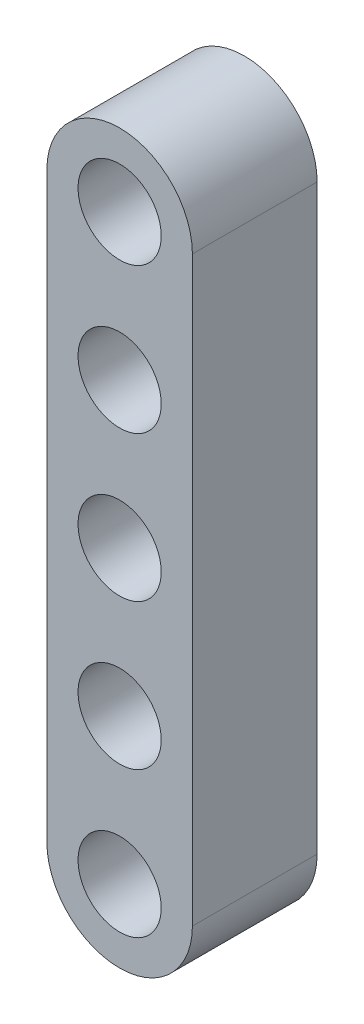
from build123d import *

# Parameters (mm, degrees)
SKETCH1_R           = 2
BOSS_EXTRUDE1_DEPTH = 6


with BuildPart() as part:
    # Sketch1 → Boss-Extrude1 (new body)
    with BuildSketch(Plane.XY):
        with BuildLine():
            Line((-3.5, 0), (-3.5, 28))
            ThreePointArc((-3.5, 28), (0, 31.5), (3.5, 28))
            Line((3.5, 28), (3.5, 0))
            ThreePointArc((3.5, 0), (0, -3.5), (-3.5, 0))
        make_face()
        Circle(SKETCH1_R, mode=Mode.SUBTRACT)
        with Locations((0, 7)):
            Circle(SKETCH1_R, mode=Mode.SUBTRACT)
        with Locations((0, 14)):
            Circle(SKETCH1_R, mode=Mode.SUBTRACT)
        with Locations((0, 21)):
            Circle(SKETCH1_R, mode=Mode.SUBTRACT)
        with Locations((0, 28)):
            Circle(SKETCH1_R, mode=Mode.SUBTRACT)
    extrude(amount=BOSS_EXTRUDE1_DEPTH)


solid = part.part
